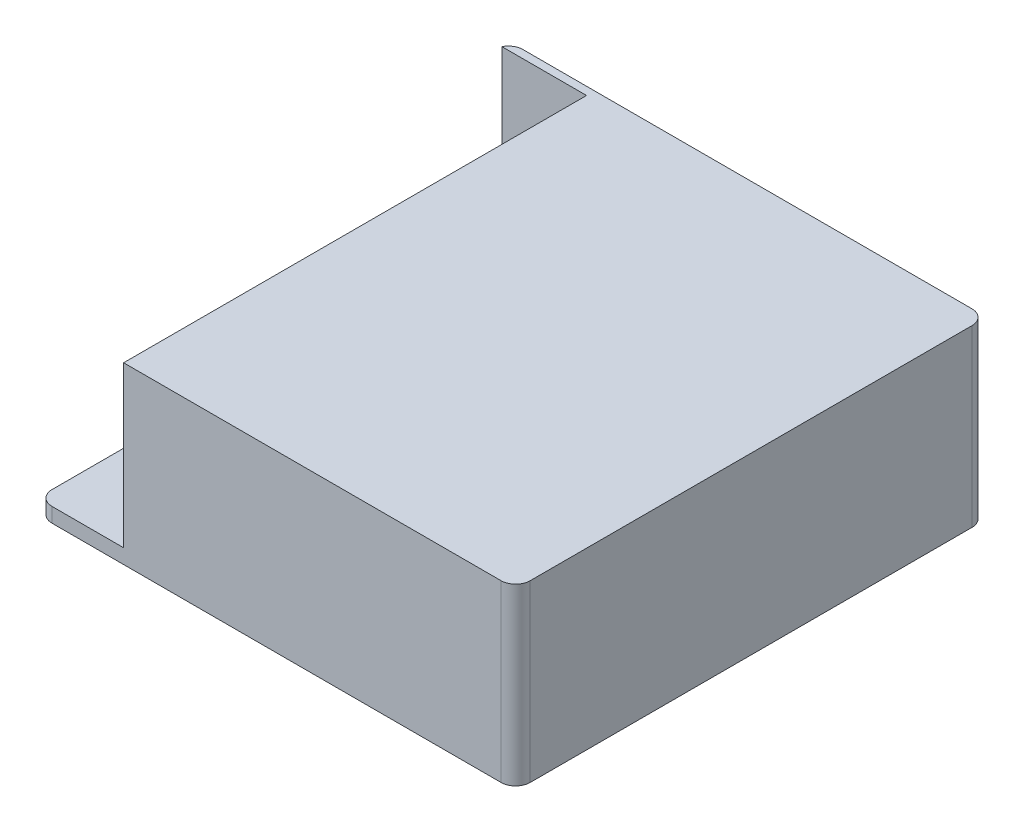
from build123d import *

# Parameters (mm, degrees)
BOSS_EXTRUDE1_DEPTH = 36
SKETCH2_W           = 25.092767626
SKETCH2_H           = 98.018623538
CUT_EXTRUDE1_DEPTH  = 33
SKETCH3_W           = 17.75334897
SKETCH3_H           = 58.288408131
BOSS_EXTRUDE2_DEPTH = 12


with BuildPart() as part:
    # Sketch1 → Boss-Extrude1 (new body)
    with BuildSketch(Plane(origin=(0, 0, 0), x_dir=(1, 0, 0), z_dir=(0, 1, 0))):
        with BuildLine():
            Line((-46.25, 48.5), (46.25, 48.5))
            ThreePointArc((46.25, 48.5), (48.371320344, 47.621320344), (49.25, 45.5))
            Line((49.25, 45.5), (49.25, -45.5))
            ThreePointArc((49.25, -45.5), (48.371320344, -47.621320344), (46.25, -48.5))
            Line((46.25, -48.5), (-46.25, -48.5))
            ThreePointArc((-46.25, -48.5), (-48.371320344, -47.621320344), (-49.25, -45.5))
            Line((-49.25, -45.5), (-49.25, 45.5))
            ThreePointArc((-49.25, 45.5), (-48.371320344, 47.621320344), (-46.25, 48.5))
        make_face()
    extrude(amount=BOSS_EXTRUDE1_DEPTH)

    # Sketch2 → Cut-Extrude1 (cut)
    with BuildSketch(Plane(origin=(0, 36, 0), x_dir=(1, 0, 0), z_dir=(0, 1, 0))):
        with Locations((-44.043034843, -2.156409718)):
            Rectangle(SKETCH2_W, SKETCH2_H)
    extrude(amount=-CUT_EXTRUDE1_DEPTH, mode=Mode.SUBTRACT)


with BuildPart() as body_2:
    # Sketch3 → Boss-Extrude2 (new body)
    with BuildSketch(Plane(origin=(0, 3, 0), x_dir=(1, 0, 0), z_dir=(0, 1, 0))):
        with Locations((-40.373325515, 8.560293123)):
            Rectangle(SKETCH3_W, SKETCH3_H)
    extrude(amount=BOSS_EXTRUDE2_DEPTH)


solid = Compound([part.part, body_2.part])
